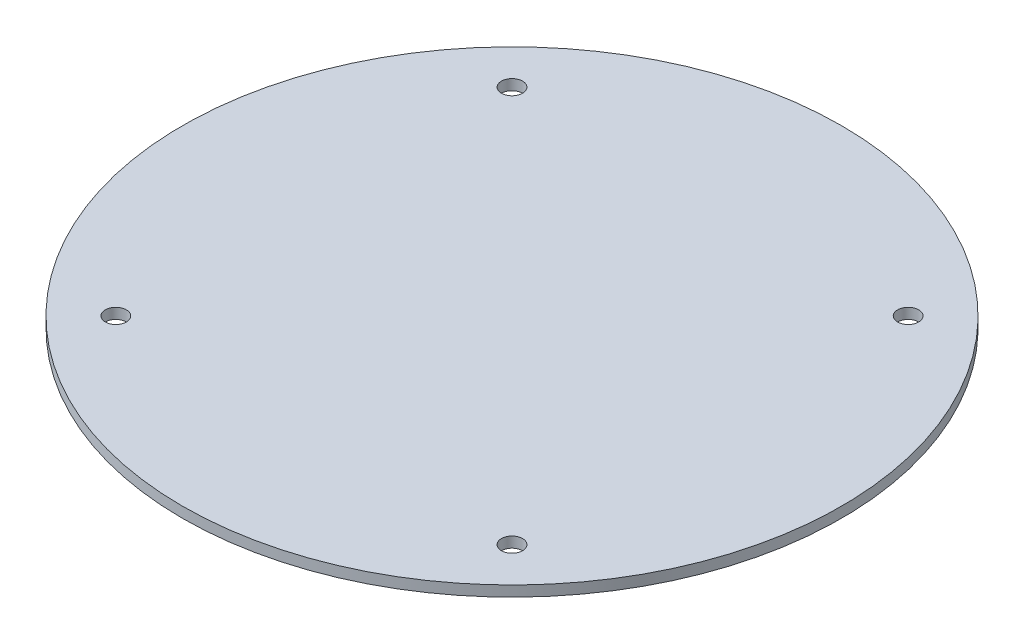
from build123d import *

# Parameters (mm, degrees)
ESBO_O1_R                = 50
RESSALTO_EXTRUS_O1_DEPTH = 1.6
ESBO_O2_R                = 1.6
CORTE_EXTRUS_O1_DEPTH    = 71.728777736


with BuildPart() as part:
    # Esboço1 → Ressalto-extrusão1 (new body)
    with BuildSketch(Plane(origin=(0, 0, 0), x_dir=(1, 0, 0), z_dir=(0, 1, 0))):
        with Locations(Location((0, 0, 0), (0, 0, 270))):
            Circle(ESBO_O1_R)
    extrude(amount=RESSALTO_EXTRUS_O1_DEPTH)

    # Esboço2 → Corte-extrusão1 (cut, through all)
    with BuildSketch(Plane.XZ):
        with Locations(Location((-30.0520382, -30.0520382, 0), (0, 0, 270))):
            Circle(ESBO_O2_R)
        with Locations(Location((-30.0520382, 30.0520382, 0), (0, 0, 270))):
            Circle(ESBO_O2_R)
        with Locations(Location((30.0520382, 30.0520382, 0), (0, 0, 270))):
            Circle(ESBO_O2_R)
        with Locations(Location((30.0520382, -30.0520382, 0), (0, 0, 270))):
            Circle(ESBO_O2_R)
    extrude(amount=-CORTE_EXTRUS_O1_DEPTH, mode=Mode.SUBTRACT)


solid = part.part
